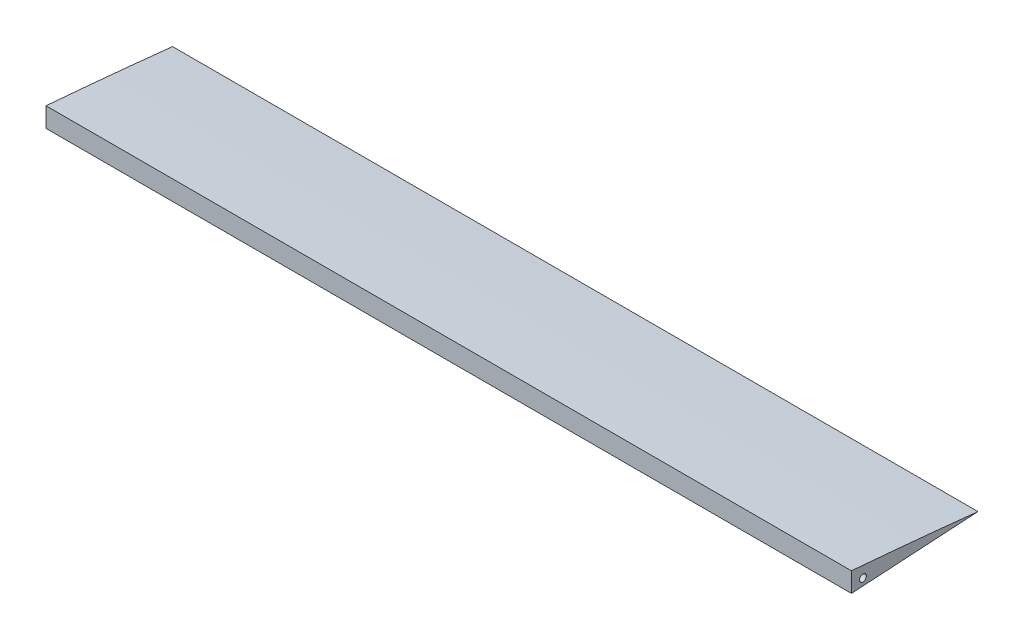
from build123d import *

# Parameters (mm, degrees)
SKETCH_1_R      = 1.5
EXTRUDE_1_DEPTH = 350


with BuildPart() as part:
    # Эскиз1 → Бобышка-Вытянуть1 (new body)
    with BuildSketch(Plane(origin=(0, 0, 0), x_dir=(0, 0, -1), z_dir=(1, 0, 0))):
        with BuildLine():
            Line((156.27368713, -3.3), (211.27368713, 0))
            ThreePointArc((211.27368713, 0), (183.789744339, 2.782062357), (156.27368713, 5.226152768))
            Line((156.27368713, 5.226152768), (156.27368713, -3.3))
        make_face()
        with Locations((161.27368713, 0)):
            Circle(SKETCH_1_R, mode=Mode.SUBTRACT)
    extrude(amount=EXTRUDE_1_DEPTH)


solid = part.part
